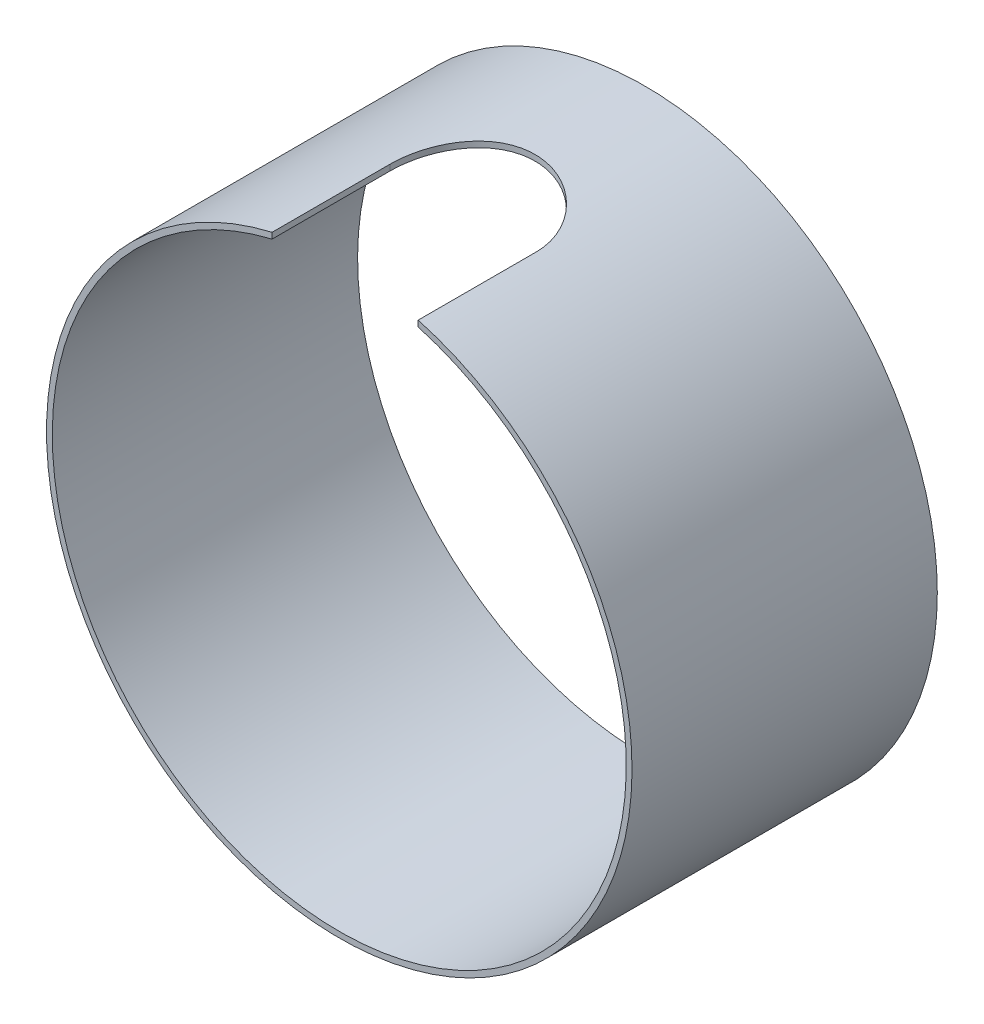
from build123d import *

# Parameters (mm, degrees)
SKETCH1_R           = 50.822
SKETCH1_R_2         = 49.822
BOSS_EXTRUDE1_DEPTH = 53
CUT_EXTRUDE1_DEPTH  = 90.301463415


with BuildPart() as part:
    # Sketch1 → Boss-Extrude1 (new body)
    with BuildSketch(Plane.XY):
        Circle(SKETCH1_R)
        Circle(SKETCH1_R_2, mode=Mode.SUBTRACT)
    extrude(amount=BOSS_EXTRUDE1_DEPTH)

    # Sketch2 → Cut-Extrude1 (cut, through all)
    with BuildSketch(Plane(origin=(0, 0, 0), x_dir=(1, 0, 0), z_dir=(0, 1, 0))):
        with BuildLine():
            Line((-11.666, -32.5), (-11.666, -53))
            Line((-11.666, -53), (13.698, -53))
            Line((13.698, -53), (13.698, -32.5))
            ThreePointArc((13.698, -32.5), (1.016, -19.818), (-11.666, -32.5))
        make_face()
    extrude(amount=CUT_EXTRUDE1_DEPTH, mode=Mode.SUBTRACT)


solid = part.part
